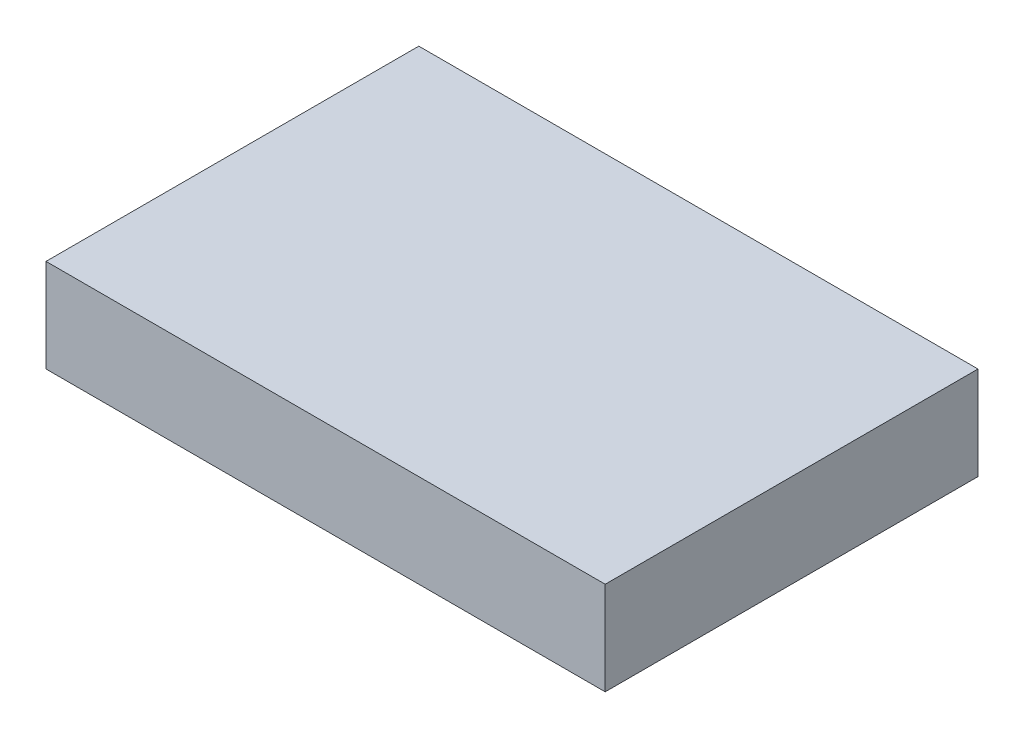
from build123d import *

# Parameters (mm, degrees)
SKETCH2_W           = 300
SKETCH2_H           = 200
BOSS_EXTRUDE1_DEPTH = 50


with BuildPart() as part:
    # Sketch2 → Boss-Extrude1 (new body)
    with BuildSketch(Plane(origin=(0, 0, 0), x_dir=(1, 0, 0), z_dir=(0, 1, 0))):
        Rectangle(SKETCH2_W, SKETCH2_H)
    extrude(amount=BOSS_EXTRUDE1_DEPTH)


solid = part.part
